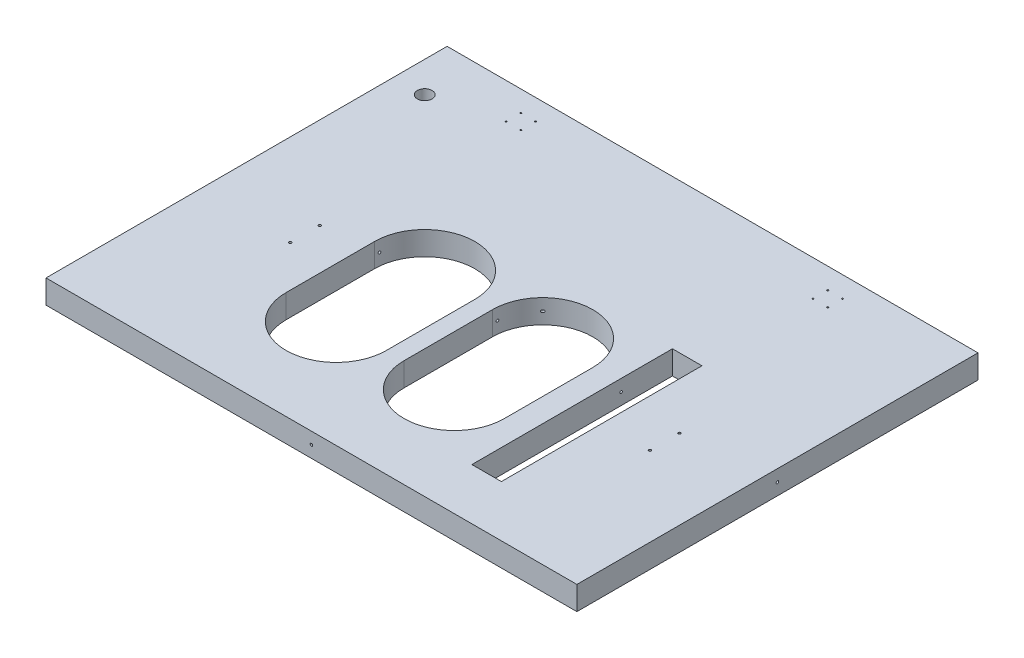
from build123d import *

# Parameters (mm, degrees)
SKETCH_1_W             = 900
SKETCH_1_H             = 680
EXTRUDE_1_DEPTH        = 40
SKETCH_2_W             = 50
SKETCH_2_H             = 340
CUT_EXTRUDE_1_DEPTH    = 566.420197729
HOLE_WIZARD_M5_1_D     = 4.2
HOLE_WIZARD_M5_2_D     = 4.2
SKETCH_9_R             = 12.5
CUT_EXTRUDE_2_DEPTH    = 566.420197876
HOLE_WIZARD_M5_3_D     = 4.2
HOLE_WIZARD_M5_3_DEPTH = 5.2
HOLE_WIZARD_M5_3_TIP   = 1.2618073
HOLE_WIZARD_M3_1_D     = 2.5
HOLE_WIZARD_M3_1_DEPTH = 8.5
HOLE_WIZARD_M3_1_TIP   = 0.751075774


with BuildPart() as part:
    # 草图1 → 凸台-拉伸1 (new body)
    with BuildSketch(Plane(origin=(0, 0, 0), x_dir=(1, 0, 0), z_dir=(0, 1, 0))):
        Rectangle(SKETCH_1_W, SKETCH_1_H)
    extrude(amount=EXTRUDE_1_DEPTH)

    # 草图2 → 切除-拉伸1 (cut, through all)
    with BuildSketch(Plane(origin=(0, 40, 0), x_dir=(1, 0, 0), z_dir=(0, 1, 0))):
        with BuildLine():
            Line((-25, -8), (-25, -158))
            ThreePointArc((-25, -158), (60, -243), (145, -158))
            Line((145, -158), (145, -8))
            ThreePointArc((145, -8), (60, 77), (-25, -8))
        make_face()
        with BuildLine():
            Line((-225, -8), (-225, -158))
            ThreePointArc((-225, -158), (-140, -243), (-55, -158))
            Line((-55, -158), (-55, -8))
            ThreePointArc((-55, -8), (-140, 77), (-225, -8))
        make_face()
        with Locations((210, -83)):
            Rectangle(SKETCH_2_W, SKETCH_2_H)
    extrude(amount=-CUT_EXTRUDE_1_DEPTH, mode=Mode.SUBTRACT)

    # M5 螺纹孔1 (through all)
    with Locations(Plane.XY.offset(340)):
        with Locations((0, 20)):
            Hole(HOLE_WIZARD_M5_1_D / 2)

    # M5 螺纹孔2 (through all)
    with Locations(Plane.ZY.offset(450)):
        with Locations((0, 20)):
            Hole(HOLE_WIZARD_M5_2_D / 2)

    # 草图9 → 切除-拉伸2 (cut, through all)
    with BuildSketch(Plane(origin=(0, 40, 0), x_dir=(1, 0, 0), z_dir=(0, 1, 0))):
        with Locations(Location((-398, 250, 0), (0, 0, 270))):
            Circle(SKETCH_9_R)
    extrude(amount=-CUT_EXTRUDE_2_DEPTH, mode=Mode.SUBTRACT)

    # M5 螺纹孔3
    with Locations(Plane(origin=(0, 40, 0), x_dir=(1, 0, 0), z_dir=(0, 1, 0))):
        with Locations((-295, -31.1), (-295, -81.1), (315, -31.1), (315, -81.1)):
            Hole(HOLE_WIZARD_M5_3_D / 2, depth=HOLE_WIZARD_M5_3_DEPTH)
            with Locations((0, 0, -(HOLE_WIZARD_M5_3_DEPTH + HOLE_WIZARD_M5_3_TIP / 2))):  # 118° drill point
                Cone(0, HOLE_WIZARD_M5_3_D / 2, HOLE_WIZARD_M5_3_TIP, mode=Mode.SUBTRACT)

    # M3 螺纹孔1
    with Locations(Plane(origin=(0, 40, 0), x_dir=(1, 0, 0), z_dir=(0, 1, 0))):
        with Locations((-289.5, 304.5), (-264.5, 304.5), (-264.5, 279.5), (-289.5, 279.5), (255.8, 304.5), (255.8, 279.5), (230.8, 279.5), (230.8, 304.5)):
            Hole(HOLE_WIZARD_M3_1_D / 2, depth=HOLE_WIZARD_M3_1_DEPTH)
            with Locations((0, 0, -(HOLE_WIZARD_M3_1_DEPTH + HOLE_WIZARD_M3_1_TIP / 2))):  # 118° drill point
                Cone(0, HOLE_WIZARD_M3_1_D / 2, HOLE_WIZARD_M3_1_TIP, mode=Mode.SUBTRACT)


solid = part.part
